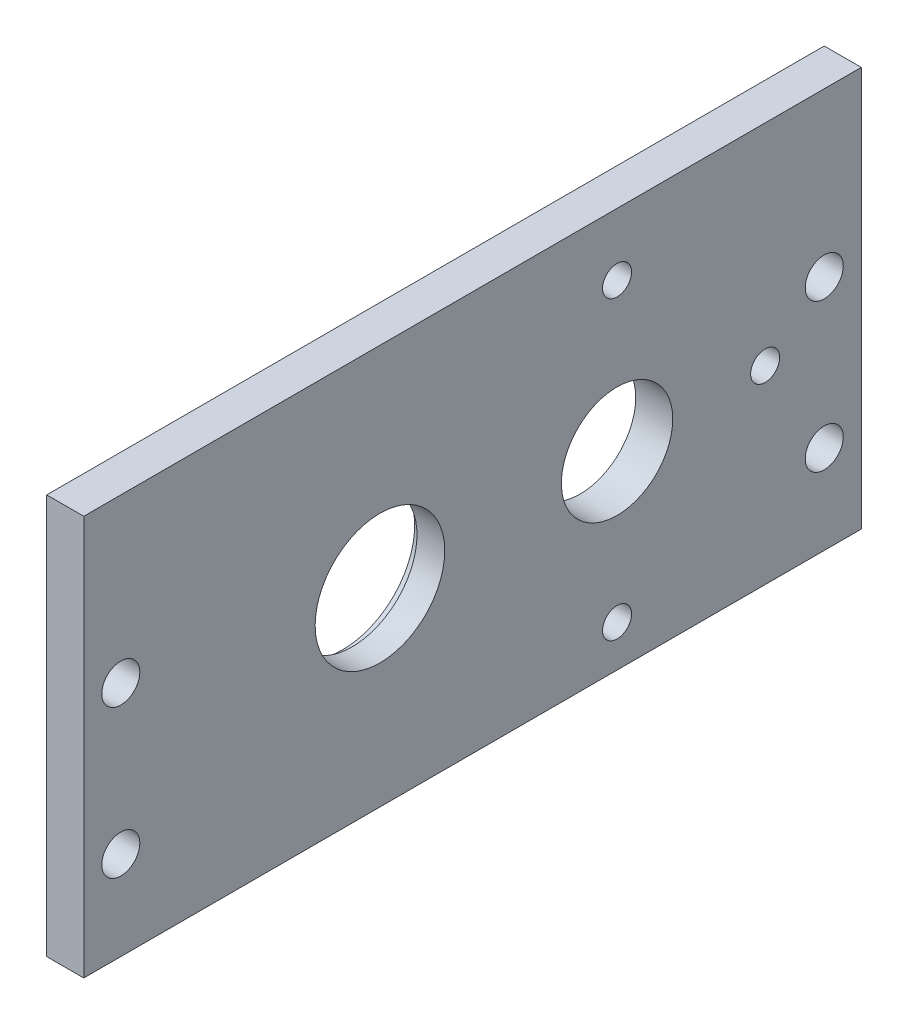
from build123d import *

# Parameters (mm, degrees)
SKETCH1_W           = 133.35
SKETCH1_H           = 68.58
SKETCH1_R           = 11.1125
SKETCH1_R_2         = 9.5504
SKETCH1_R_3         = 2.4892
SKETCH1_R_4         = 3.2639
BOSS_EXTRUDE1_DEPTH = 6.35
SKETCH2_R           = 12.3063
CUT_EXTRUDE1_DEPTH  = 1.5875


with BuildPart() as part:
    # Sketch1 → Boss-Extrude1 (new body)
    with BuildSketch(Plane(origin=(0, 0, 0), x_dir=(0, 0, -1), z_dir=(1, 0, 0))):
        with Locations((15.875, 1.778)):
            Rectangle(SKETCH1_W, SKETCH1_H)
        Circle(SKETCH1_R, mode=Mode.SUBTRACT)
        with Locations((40.6654, 0)):
            Circle(SKETCH1_R_2, mode=Mode.SUBTRACT)
        with Locations((40.6654, 25.4)):
            Circle(SKETCH1_R_3, mode=Mode.SUBTRACT)
        with Locations((40.6654, -25.4)):
            Circle(SKETCH1_R_3, mode=Mode.SUBTRACT)
        with Locations((66.0654, 0)):
            Circle(SKETCH1_R_3, mode=Mode.SUBTRACT)
        with Locations((76.2, -17.272)):
            Circle(SKETCH1_R_4, mode=Mode.SUBTRACT)
        with Locations((76.2, 8.128)):
            Circle(SKETCH1_R_4, mode=Mode.SUBTRACT)
        with Locations((-44.45, 8.128)):
            Circle(SKETCH1_R_4, mode=Mode.SUBTRACT)
        with Locations((-44.45, -17.272)):
            Circle(SKETCH1_R_4, mode=Mode.SUBTRACT)
    extrude(amount=BOSS_EXTRUDE1_DEPTH)

    # Sketch2 → Cut-Extrude1 (cut)
    with BuildSketch(Plane.ZY):
        Circle(SKETCH2_R)
    extrude(amount=-CUT_EXTRUDE1_DEPTH, mode=Mode.SUBTRACT)


solid = part.part
